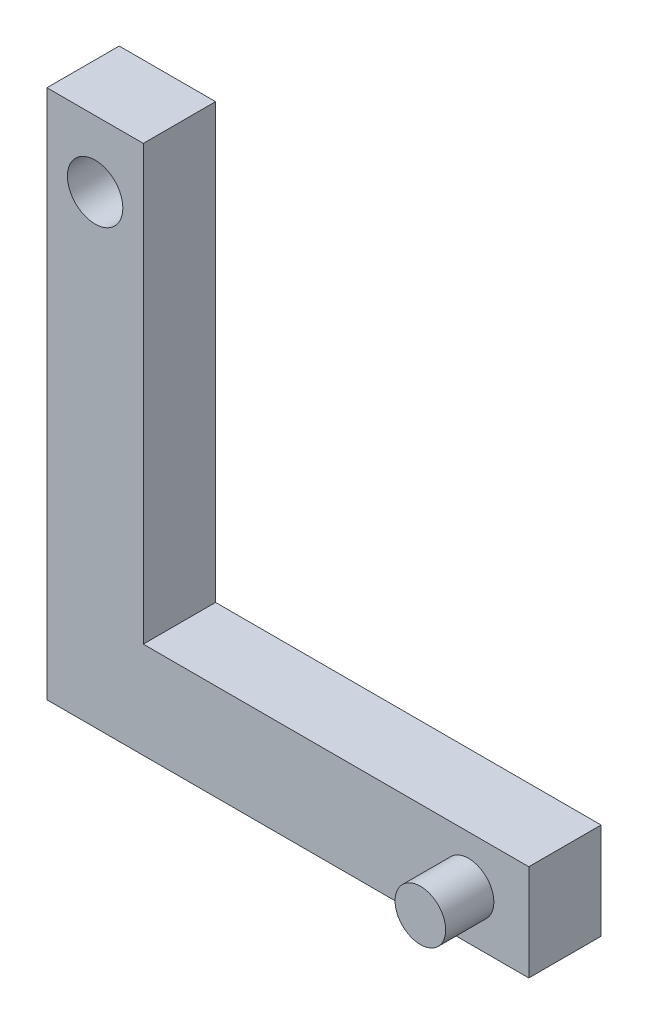
from build123d import *

# Parameters (mm, degrees)
CROQUIS1_W              = 20
CROQUIS1_H              = 4
SALIENTE_EXTRUIR1_DEPTH = 3
CROQUIS5_W              = 4
CROQUIS5_H              = 18
SALIENTE_EXTRUIR2_DEPTH = 3
CROQUIS5_5_R            = 1.15
CORTAR_EXTRUIR3_DEPTH   = 28.073972741
CROQUIS3_R              = 1.05
SALIENTE_EXTRUIR4_DEPTH = 5


with BuildPart() as part:
    # Croquis1 → Saliente-Extruir1 (new body)
    with BuildSketch(Plane.XY):
        with Locations((10, -2)):
            Rectangle(CROQUIS1_W, CROQUIS1_H)
    extrude(amount=SALIENTE_EXTRUIR1_DEPTH)

    # Croquis5 → Saliente-Extruir2 (add)
    with BuildSketch(Plane.XY.offset(3)):
        with Locations((2, 9)):
            Rectangle(CROQUIS5_W, CROQUIS5_H)
    extrude(amount=-SALIENTE_EXTRUIR2_DEPTH)

    # Croquis5<5> → Cortar-Extruir3 (cut, through all)
    with BuildSketch(Plane.XY.offset(3)):
        with Locations((2, 15.25)):
            Circle(CROQUIS5_5_R)
    extrude(amount=-CORTAR_EXTRUIR3_DEPTH, mode=Mode.SUBTRACT)

    # Croquis3 → Saliente-Extruir4 (add)
    with BuildSketch(Plane(origin=(0, 0, 0), x_dir=(-1, 0, 0), z_dir=(0, 0, -1))):
        with Locations((-17.5, -2)):
            Circle(CROQUIS3_R)
    extrude(amount=-SALIENTE_EXTRUIR4_DEPTH)


solid = part.part
